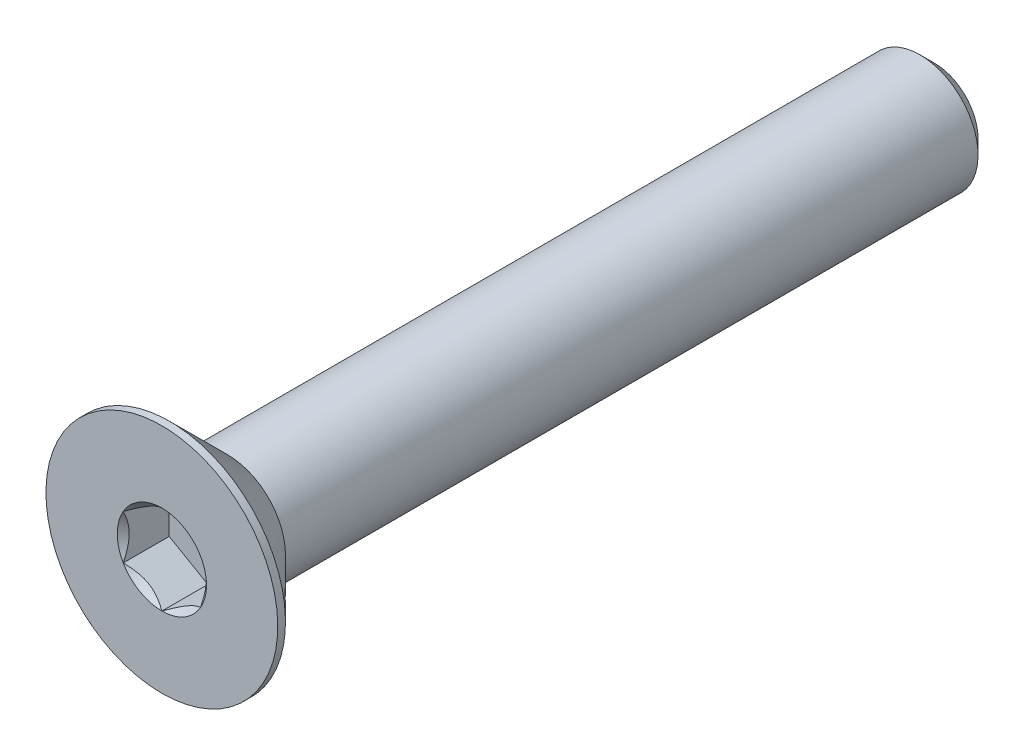
from build123d import *

# Parameters (mm, degrees)
SKETCH1_W          = 20
SKETCH1_H          = 1.5
CHAMFER1_SIZE      = 0.375
CUT_EXTRUDE2_DEPTH = 1.19


with BuildPart() as part:
    # Sketch1 → Revolve1 (revolve)
    with BuildSketch(Plane(origin=(0, 0, 0), x_dir=(0, 0, -1), z_dir=(1, 0, 0))):
        with Locations((10, 0.75)):
            Rectangle(SKETCH1_W, SKETCH1_H)
    revolve(axis=Axis((0, 0, -20), (0, 0, 1)))

    # Chamfer1
    chamfer1_edges = [part.edges().sort_by_distance(p)[0] for p in [
        (0, -1.5, -20),
    ]]
    chamfer(chamfer1_edges, length=CHAMFER1_SIZE)

    # Sketch7 → Revolve2 (revolve)
    with BuildSketch(Plane(origin=(0, 0, 0), x_dir=(0, 0, -1), z_dir=(1, 0, 0)), mode=Mode.PRIVATE) as revolve2_sk:
        Polygon((0, 3), (0.2, 3), (1.7, 1.5), (1.7, 0), (0, 0), align=None)
    revolve(revolve2_sk.sketch.rotate(Axis((0, 0, 0), (0, 0, -1)), 180), axis=Axis((0, 0, 0), (0, 0, -1)))

    # Boss-Extrude1 cone 1 section (through the dimple's axis) → Boss-Extrude1 (revolve)
    with BuildSketch(Plane(origin=(0, 0, -1.7), x_dir=(0, -1, 0), z_dir=(1, 0, 0))):
        Polygon((0, 0), (1.5, 0), (0, 1.5), align=None)
    revolve(axis=Axis((0, 0, -1.7), (0, 0, -1)))

    # Sketch5 → Cut-Extrude2 (cut)
    with BuildSketch(Plane.XY):
        Polygon((1, -0.577350269), (1, 0.577350269), (0, 1.154700538), (-1, 0.577350269), (-1, -0.577350269), (0, -1.154700538), align=None)
    extrude(amount=-CUT_EXTRUDE2_DEPTH, mode=Mode.SUBTRACT)

    # Cut-Extrude3 cone 1 section (through the dimple's axis) → Cut-Extrude3 (revolve, cut)
    with BuildSketch(Plane(origin=(0, 0, 0), x_dir=(0, -1, 0), z_dir=(1, 0, 0))):
        Polygon((0, 0), (1.154700538, 0), (0, 1.154700538), align=None)
    revolve(axis=Axis((0, 0, 0), (0, 0, -1)), mode=Mode.SUBTRACT)


solid = part.part
